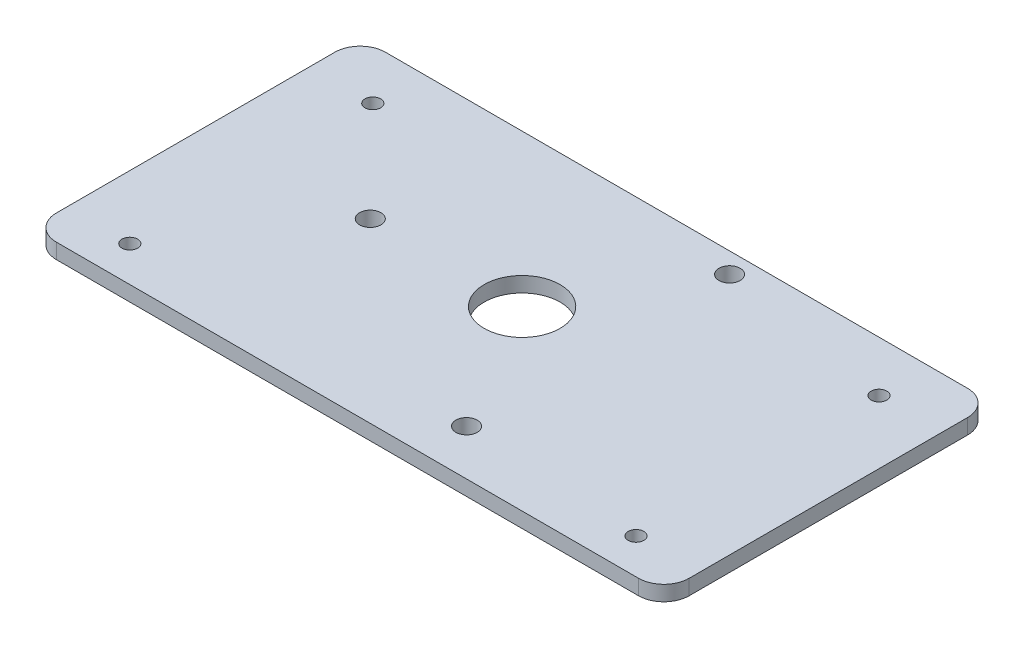
from build123d import *

# Parameters (mm, degrees)
SKETCH_1_W          = 125
SKETCH_1_H          = 65
EXTRUDE_1_DEPTH     = 3
SKETCH_2_R          = 1.55
SKETCH_2_R_2        = 2.1
SKETCH_2_R_3        = 7.5
CUT_EXTRUDE_1_DEPTH = 3
FILLET_1_R          = 5


with BuildPart() as part:
    # 草图1 → 凸台-拉伸1 (new body)
    with BuildSketch(Plane(origin=(0, 0, 0), x_dir=(1, 0, 0), z_dir=(0, 1, 0))):
        Rectangle(SKETCH_1_W, SKETCH_1_H)
    extrude(amount=EXTRUDE_1_DEPTH)

    # 草图2 → 切除-拉伸1 (cut)
    with BuildSketch(Plane(origin=(0, 0, 0), x_dir=(-1, 0, 0), z_dir=(0, -1, 0))):
        with Locations(Location((-50, 22.5, 0), (0, 0, 90))):
            Circle(SKETCH_2_R)
        with Locations(Location((-50, -25.5, 0), (0, 0, 90))):
            Circle(SKETCH_2_R)
        with Locations(Location((50, 22.5, 0), (0, 0, 90))):
            Circle(SKETCH_2_R)
        with Locations(Location((50, -25.5, 0), (0, 0, 90))):
            Circle(SKETCH_2_R)
        with Locations(Location((-14.5, -23.480762114, 0), (0, 0, 90))):
            Circle(SKETCH_2_R_2)
        with Locations(Location((-14.5, 28.480762114, 0), (0, 0, 90))):
            Circle(SKETCH_2_R_2)
        with Locations(Location((30.5, 2.5, 0), (0, 0, 90))):
            Circle(SKETCH_2_R_2)
        with Locations(Location((0.5, 2.5, 0), (0, 0, 90))):
            Circle(SKETCH_2_R_3)
    extrude(amount=-CUT_EXTRUDE_1_DEPTH, mode=Mode.SUBTRACT)

    # 圆角1
    fillet_1_edges = [part.edges().sort_by_distance(p)[0] for p in [
        (62.5, 1.5, 32.5),
        (-62.5, 1.5, 32.5),
        (-62.5, 1.5, -32.5),
        (62.5, 1.5, -32.5),
    ]]
    fillet(fillet_1_edges, radius=FILLET_1_R)


solid = part.part
